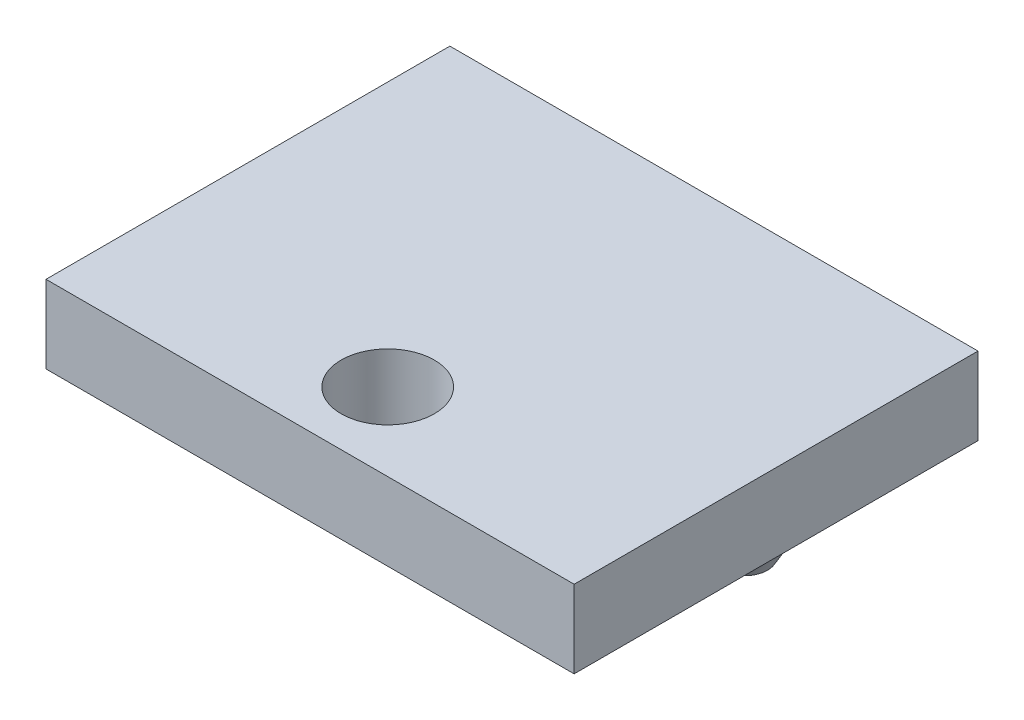
from build123d import *

# Parameters (mm, degrees)
SKETCH1_R             = 2.45
BOSS_EXTRUDE1_DEPTH   = 6
BOSS_EXTRUDE1_2_DEPTH = 6
CHAMFER1_SIZE         = 1
CHAMFER1_SIZE2        = 1.732050808
CHAMFER2_SIZE         = 1
CHAMFER2_SIZE2        = 1.732050808
SKETCH3_W             = 34
SKETCH3_H             = 26
BOSS_EXTRUDE2_DEPTH   = 5
SKETCH6_R             = 3
CUT_EXTRUDE2_DEPTH    = 26.475478406


with BuildPart() as part:
    # Sketch1 → Boss-Extrude1 (new body)
    with BuildSketch(Plane(origin=(0, 0, 0), x_dir=(1, 0, 0), z_dir=(0, 1, 0))):
        with Locations(Location((-10, 0, 0), (0, 0, 270))):
            Circle(SKETCH1_R)
    extrude(amount=-BOSS_EXTRUDE1_DEPTH)

    # Chamfer2
    chamfer2_edges = [part.edges().sort_by_distance(p)[0] for p in [
        (-10, -6, -2.45),
    ]]
    chamfer2_side = [part.faces().sort_by_distance(p)[0] for p in [
        (-10, -6, 0),
    ]]
    chamfer(chamfer2_edges, length=CHAMFER2_SIZE, length2=CHAMFER2_SIZE2, reference=chamfer2_side[0])



with BuildPart() as body_2:
    # Sketch1 → Boss-Extrude1 2 (new body)
    with BuildSketch(Plane(origin=(0, 0, 0), x_dir=(1, 0, 0), z_dir=(0, 1, 0))):
        with Locations(Location((10, 0, 0), (0, 0, 270))):
            Circle(SKETCH1_R)
    extrude(amount=-BOSS_EXTRUDE1_2_DEPTH)

    # Chamfer1
    chamfer1_edges = [body_2.edges().sort_by_distance(p)[0] for p in [
        (10, -6, -2.45),
    ]]
    chamfer1_side = [body_2.faces().sort_by_distance(p)[0] for p in [
        (10, -6, 0),
    ]]
    chamfer(chamfer1_edges, length=CHAMFER1_SIZE, length2=CHAMFER1_SIZE2, reference=chamfer1_side[0])


with BuildPart() as part_1:
    add(part.part)

    add(body_2.part)  # Boss-Extrude2 merges body 2
    # Sketch3 → Boss-Extrude2 (add)
    with BuildSketch(Plane(origin=(0, 0, 0), x_dir=(1, 0, 0), z_dir=(0, 1, 0))):
        with Locations((0, -5)):
            Rectangle(SKETCH3_W, SKETCH3_H)
    extrude(amount=BOSS_EXTRUDE2_DEPTH)

    # Sketch6 → Cut-Extrude2 (cut, through all)
    with BuildSketch(Plane.XZ):
        with Locations(Location((0, 13, 0), (0, 0, 270))):
            Circle(SKETCH6_R)
    extrude(amount=-CUT_EXTRUDE2_DEPTH, mode=Mode.SUBTRACT)


solid = part_1.part
